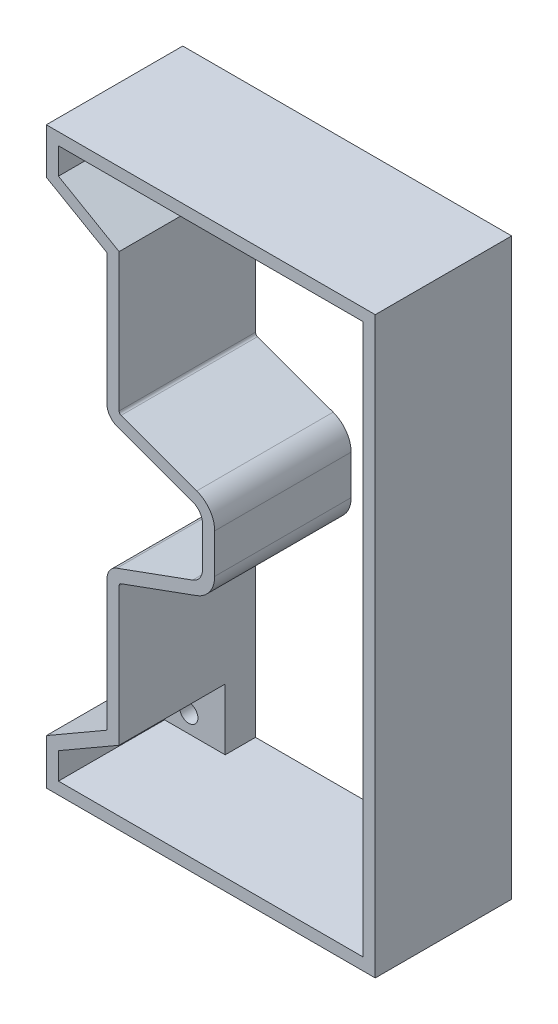
from build123d import *

# Parameters (mm, degrees)
SKETCH_1_R      = 0.6
EXTRUDE_1_DEPTH = 2
EXTRUDE_2_DEPTH = 7


with BuildPart() as part:
    # Эскиз1 → Бобышка-Вытянуть1 (new body)
    with BuildSketch(Plane.XY):
        with BuildLine():
            Line((9.649784207, -2.239485083), (4.657979857, -4.056353282))
            ThreePointArc((4.657979857, -4.056353282), (4.180847956, -4.422469466), (4, -4.996045902))
            Line((4, -4.996045902), (4, -13.640598923))
            Line((4, -13.640598923), (0, -15.95))
            Line((0, -15.95), (0, -18.95))
            Line((0, -18.95), (21.7, -18.95))
            Line((21.7, -18.95), (21.7, 18.95))
            Line((21.7, 18.95), (0, 18.95))
            Line((0, 18.95), (0, 15.95))
            Line((0, 15.95), (4, 13.640598923))
            Line((4, 13.640598923), (4, 4.996045902))
            ThreePointArc((4, 4.996045902), (4.180847956, 4.422469466), (4.657979857, 4.056353282))
            Line((4.657979857, 4.056353282), (9.649784207, 2.239485083))
            ThreePointArc((9.649784207, 2.239485083), (10.126916108, 1.873368898), (10.307764064, 1.299792462))
            Line((10.307764064, 1.299792462), (10.307764064, -1.299792462))
            ThreePointArc((10.307764064, -1.299792462), (10.126916108, -1.873368898), (9.649784207, -2.239485083))
        make_face()
        with Locations((2.4, -16.95)):
            Circle(SKETCH_1_R, mode=Mode.SUBTRACT)
        with Locations((2.4, 16.95)):
            Circle(SKETCH_1_R, mode=Mode.SUBTRACT)
        with Locations((19.3, -16.95)):
            Circle(SKETCH_1_R, mode=Mode.SUBTRACT)
        with Locations((19.3, 16.95)):
            Circle(SKETCH_1_R, mode=Mode.SUBTRACT)
        with BuildLine():
            Line((4.8, -18.15), (15.9, -18.15))
            Line((15.9, -18.15), (20.9, -13.15))
            Line((20.9, -13.15), (20.9, 13.15))
            Line((20.9, 13.15), (15.9, 18.15))
            Line((15.9, 18.15), (4.8, 18.15))
            Line((4.8, 18.15), (4.8, 14.102479139))
            Line((4.8, 14.102479139), (4.8, 4.996045902))
            ThreePointArc((4.8, 4.996045902), (4.836169591, 4.881330615), (4.931595971, 4.808107378))
            Line((4.931595971, 4.808107378), (9.923400322, 2.991239179))
            ThreePointArc((9.923400322, 2.991239179), (10.782237744, 2.332230047), (11.107764064, 1.299792462))
            Line((11.107764064, 1.299792462), (11.107764064, -1.299792462))
            ThreePointArc((11.107764064, -1.299792462), (10.782237744, -2.332230047), (9.923400322, -2.991239179))
            Line((9.923400322, -2.991239179), (4.931595971, -4.808107378))
            ThreePointArc((4.931595971, -4.808107378), (4.836169591, -4.881330615), (4.8, -4.996045902))
            Line((4.8, -4.996045902), (4.8, -14.102479139))
            Line((4.8, -14.102479139), (4.8, -18.15))
        make_face(mode=Mode.SUBTRACT)
    extrude(amount=EXTRUDE_1_DEPTH)

    # Эскиз3 → Бобышка-Вытянуть2 (add)
    with BuildSketch(Plane.XY.offset(2)):
        with BuildLine():
            Line((9.649784207, -2.239485083), (4.657979857, -4.056353282))
            ThreePointArc((4.657979857, -4.056353282), (4.180847956, -4.422469466), (4, -4.996045902))
            Line((4, -4.996045902), (4, -13.640598923))
            Line((4, -13.640598923), (0, -15.95))
            Line((0, -15.95), (0, -18.95))
            Line((0, -18.95), (21.7, -18.95))
            Line((21.7, -18.95), (21.7, 18.95))
            Line((21.7, 18.95), (0, 18.95))
            Line((0, 18.95), (0, 15.95))
            Line((0, 15.95), (4, 13.640598923))
            Line((4, 13.640598923), (4, 4.996045902))
            ThreePointArc((4, 4.996045902), (4.180847956, 4.422469466), (4.657979857, 4.056353282))
            Line((4.657979857, 4.056353282), (9.649784207, 2.239485083))
            ThreePointArc((9.649784207, 2.239485083), (10.126916108, 1.873368898), (10.307764064, 1.299792462))
            Line((10.307764064, 1.299792462), (10.307764064, -1.299792462))
            ThreePointArc((10.307764064, -1.299792462), (10.126916108, -1.873368898), (9.649784207, -2.239485083))
        make_face()
        with BuildLine():
            Line((0.8, -18.15), (20.9, -18.15))
            Line((20.9, -18.15), (20.9, 18.15))
            Line((20.9, 18.15), (0.8, 18.15))
            Line((0.8, 18.15), (0.8, 16.411880215))
            Line((0.8, 16.411880215), (4.8, 14.102479139))
            Line((4.8, 14.102479139), (4.8, 4.996045902))
            ThreePointArc((4.8, 4.996045902), (4.836169591, 4.881330615), (4.931595971, 4.808107378))
            Line((4.931595971, 4.808107378), (9.923400322, 2.991239179))
            ThreePointArc((9.923400322, 2.991239179), (10.782237744, 2.332230047), (11.107764064, 1.299792462))
            Line((11.107764064, 1.299792462), (11.107764064, -1.299792462))
            ThreePointArc((11.107764064, -1.299792462), (10.782237744, -2.332230047), (9.923400322, -2.991239179))
            Line((9.923400322, -2.991239179), (4.931595971, -4.808107378))
            ThreePointArc((4.931595971, -4.808107378), (4.836169591, -4.881330615), (4.8, -4.996045902))
            Line((4.8, -4.996045902), (4.8, -14.102479139))
            Line((4.8, -14.102479139), (0.8, -16.411880215))
            Line((0.8, -16.411880215), (0.8, -18.15))
        make_face(mode=Mode.SUBTRACT)
    extrude(amount=EXTRUDE_2_DEPTH)


solid = part.part
